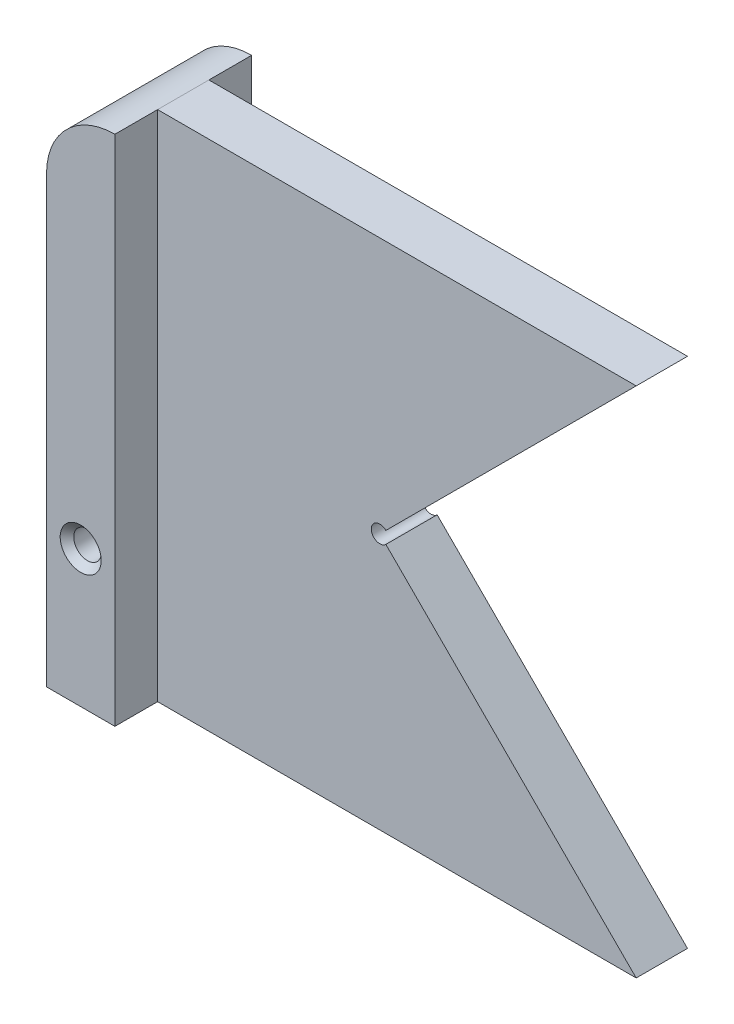
from build123d import *

# Parameters (mm, degrees)
BOSS_EXTRUDE1_DEPTH               = 12.7
F_1_8_0_125_DIAMETER_HOLE1_D      = 3.175
FILLET1_R                         = 12.7
F_1_4_20_TAPPED_HOLE2_D           = 5.1054
F_1_4_20_TAPPED_HOLE2_DEPTH       = 15.875
F_1_4_20_TAPPED_HOLE2_CSINK_D     = 7.62
F_1_4_20_TAPPED_HOLE2_CSINK_ANGLE = 90
F_1_4_20_TAPPED_HOLE2_TIP         = 1.533816902
SKETCH10_W                        = 88.9
SKETCH10_H                        = 7.9375
CUT_EXTRUDE1_DEPTH                = 140.844243714


with BuildPart() as part:
    # Sketch2 → Boss-Extrude1 (new, symmetric)
    with BuildSketch(Plane.XY):
        Polygon((0, 0), (0, 95.25), (101.6, 95.25), (53.975, 47.625), (101.6, 0), align=None)
    extrude(amount=BOSS_EXTRUDE1_DEPTH, both=True)

    # 1/8 (0.125) Diameter Hole1 (through all)
    with Locations(Plane.XY.offset(12.7)):
        with Locations((53.975, 47.625)):
            Hole(F_1_8_0_125_DIAMETER_HOLE1_D / 2)

    # Fillet1
    fillet1_edges = [part.edges().sort_by_distance(p)[0] for p in [
        (0, 95.25, 0),
    ]]
    fillet(fillet1_edges, radius=FILLET1_R)

    # Sketch5 → 1/4-20 Tapped Hole1 (revolve, cut)
    with BuildSketch(Plane(origin=(6.35, 25.4, 12.7), x_dir=(0, -1, 0), z_dir=(1, 0, 0))):
        Polygon((0, 0), (0, 25.4), (3.81, 25.4), (2.5527, 24.1427), (2.5527, 1.2573), (3.81, 0), align=None)
    revolve(axis=Axis((6.35, 25.4, 19.05), (0, 0, -1)), mode=Mode.SUBTRACT)

    # 1/4-20 Tapped Hole2
    with Locations(Plane.ZY):
        with Locations((0, 41.275), (0, 9.525)):
            CounterSinkHole(F_1_4_20_TAPPED_HOLE2_D / 2, F_1_4_20_TAPPED_HOLE2_CSINK_D / 2, depth=F_1_4_20_TAPPED_HOLE2_DEPTH, counter_sink_angle=F_1_4_20_TAPPED_HOLE2_CSINK_ANGLE)
            with Locations((0, 0, -(F_1_4_20_TAPPED_HOLE2_DEPTH + F_1_4_20_TAPPED_HOLE2_TIP / 2))):  # 118° drill point
                Cone(0, F_1_4_20_TAPPED_HOLE2_D / 2, F_1_4_20_TAPPED_HOLE2_TIP, mode=Mode.SUBTRACT)

    # Sketch10 → Cut-Extrude1 (cut, through all)
    with BuildSketch(Plane(origin=(0, 95.25, 0), x_dir=(1, 0, 0), z_dir=(0, 1, 0))):
        with Locations((57.15, 8.73125)):
            Rectangle(SKETCH10_W, SKETCH10_H)
        with Locations((57.15, -8.73125)):
            Rectangle(SKETCH10_W, SKETCH10_H)
    extrude(amount=-CUT_EXTRUDE1_DEPTH, mode=Mode.SUBTRACT)


solid = part.part
